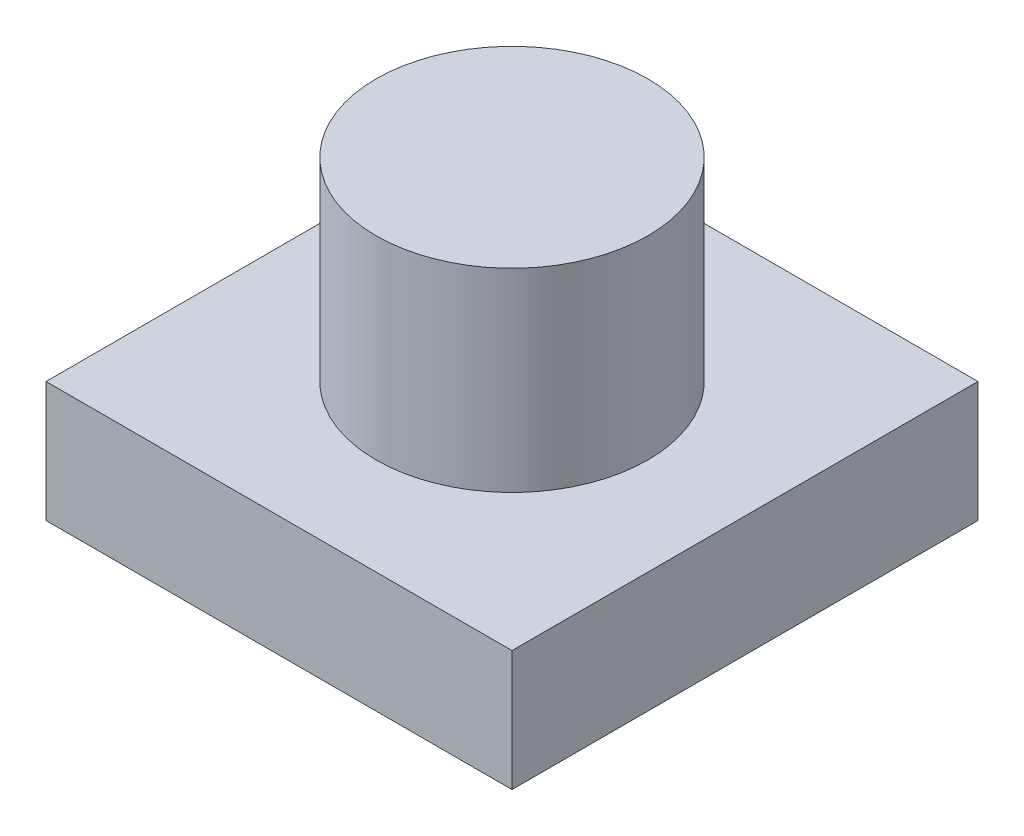
from build123d import *

# Parameters (mm, degrees)
SKETCH_1_W      = 12
SKETCH_1_H      = 12
EXTRUDE_1_DEPTH = 3.1
SKETCH_2_R      = 3.5
EXTRUDE_2_DEPTH = 5


with BuildPart() as part:
    # 草图1 → 拉伸1 (new body)
    with BuildSketch(Plane(origin=(0, 0, 0), x_dir=(1, 0, 0), z_dir=(0, 1, 0))):
        Rectangle(SKETCH_1_W, SKETCH_1_H)
    extrude(amount=EXTRUDE_1_DEPTH)

    # 草图2 → 拉伸2 (add)
    with BuildSketch(Plane(origin=(0, 3.1, 0), x_dir=(-1, 0, 0), z_dir=(0, 1, 0))):
        with Locations(Location((0, 0, 0), (0, 0, 90))):
            Circle(SKETCH_2_R)
    extrude(amount=EXTRUDE_2_DEPTH)


solid = part.part
